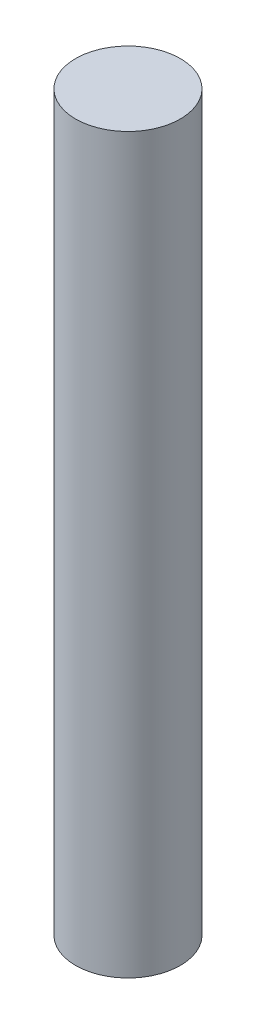
from build123d import *

# Parameters (mm, degrees)
SKETCH_1_R      = 4
EXTRUDE_1_DEPTH = 56


with BuildPart() as part:
    # 草图1 → 凸台-拉伸1 (new body)
    with BuildSketch(Plane(origin=(0, 0, 0), x_dir=(1, 0, 0), z_dir=(0, 1, 0))):
        with Locations(Location((0, 0, 0), (0, 0, 270))):
            Circle(SKETCH_1_R)
    extrude(amount=EXTRUDE_1_DEPTH)


solid = part.part
